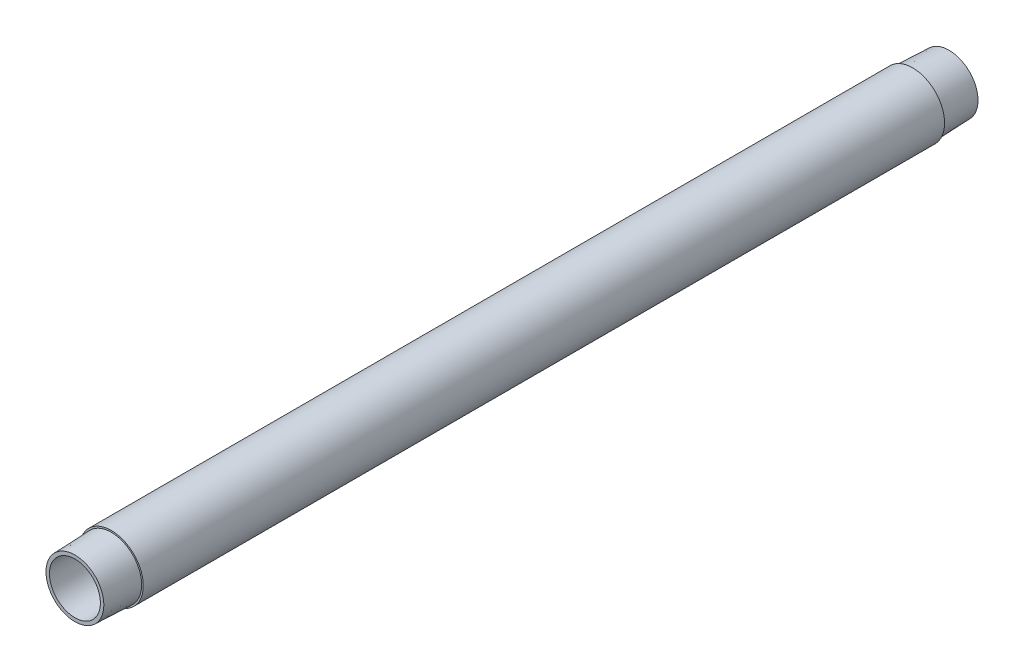
from build123d import *

# Parameters (mm, degrees)
SKETCH2_R           = 16.7005
SKETCH2_R_2         = 13.3223
BOSS_EXTRUDE1_DEPTH = 457.2


with BuildPart() as part:
    # Sketch2 → Boss-Extrude1 (new body)
    with BuildSketch(Plane.XY):
        Circle(SKETCH2_R)
        Circle(SKETCH2_R_2, mode=Mode.SUBTRACT)
    extrude(amount=BOSS_EXTRUDE1_DEPTH)

    # Sketch3 → Cut-Revolve2 (revolve, cut)
    with BuildSketch(Plane(origin=(0, 0, 0), x_dir=(0, 0, -1), z_dir=(1, 0, 0)), mode=Mode.PRIVATE) as cut_revolve2_sk:
        Polygon((0, 21.813584822), (-19.05, 21.813584822), (-19.05, 16.7005), (-19.05, 15.869250272), (0, 15.126208453), align=None)
        Polygon((-457.2, 15.126208453), (-457.2, 21.813584822), (-438.15, 21.813584822), (-438.15, 16.7005), (-438.15, 15.869250272), align=None)
    revolve(cut_revolve2_sk.sketch.rotate(Axis((0, 0, 228.6), (0, 0, -1)), 180), axis=Axis((0, 0, 228.6), (0, 0, -1)), mode=Mode.SUBTRACT)


solid = part.part
